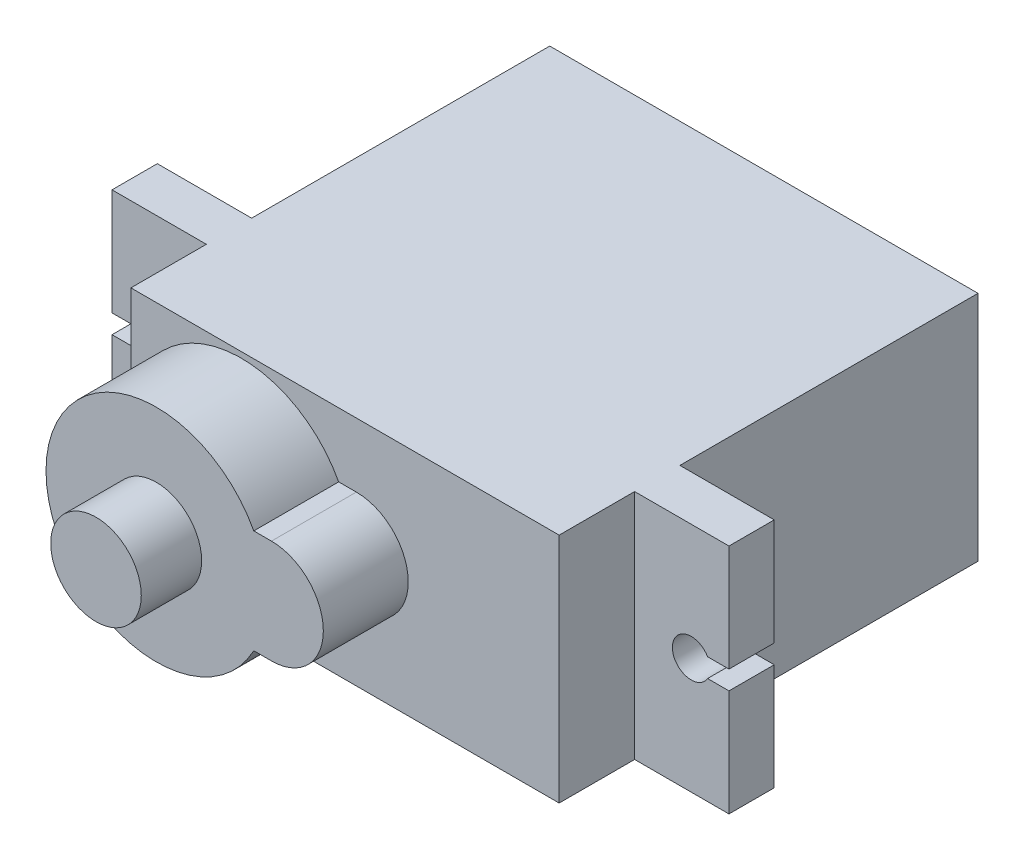
from build123d import *

# Parameters (mm, degrees)
SZKIC1_W                         = 22.7
SZKIC1_H                         = 12.3
DODANIE_WYCI_GNI_CIE1_DEPTH      = 22.2
DODANIE_WYCI_GNI_CIE2_DEPTH      = 5
DODANIE_WYCI_GNI_CIE2_DEPTH_BACK = 27.7
SZKIC2_W                         = 2.4
SZKIC2_H                         = 12.3
DODANIE_WYCI_GNI_CIE3_DEPTH      = 4.5
SZKIC8_R                         = 2.4
DODANIE_WYCI_GNI_CIE4_DEPTH      = 3.2
WYTNIJ_WYCI_GNI_CIE1_DEPTH       = 2.4
WYTNIJ_WYCI_GNI_CIE2_DEPTH       = 2.4
SZKIC11_R                        = 0.75
DODANIE_WYCI_GNI_CIE8_DEPTH      = 25.7


with BuildPart() as part:
    # Szkic1 → Dodanie-wyciągnięcie1 (new body)
    with BuildSketch(Plane.XY):
        with Locations((-11.570890411, -6.425490196)):
            Rectangle(SZKIC1_W, SZKIC1_H)
    extrude(amount=DODANIE_WYCI_GNI_CIE1_DEPTH)

    # Szkic2 → Dodanie-wyciągnięcie2 (add, two sides: drawn at the far end of the back side and taken through both)
    with BuildSketch(Plane(origin=(-0.220890411, 0, 0), x_dir=(0, 0, -1), z_dir=(1, 0, 0)).offset(-DODANIE_WYCI_GNI_CIE2_DEPTH_BACK)):
        with Locations((-17, -6.425490196)):
            Rectangle(SZKIC2_W, SZKIC2_H)
    extrude(amount=DODANIE_WYCI_GNI_CIE2_DEPTH + DODANIE_WYCI_GNI_CIE2_DEPTH_BACK)

    # Szkic3 → Dodanie-wyciągnięcie3 (add)
    with BuildSketch(Plane.XY.offset(22.2)):
        with BuildLine():
            Line((-10.970890411, -9.175490196), (-11.907558154, -9.175490196))
            ThreePointArc((-11.907558154, -9.175490196), (-22.920890411, -6.425490196), (-11.907558154, -3.675490196))
            Line((-11.907558154, -3.675490196), (-10.970890411, -3.675490196))
            ThreePointArc((-10.970890411, -3.675490196), (-8.220890411, -6.425490196), (-10.970890411, -9.175490196))
        make_face()
    extrude(amount=DODANIE_WYCI_GNI_CIE3_DEPTH)

    # Szkic8 → Dodanie-wyciągnięcie4 (add)
    with BuildSketch(Plane.XY.offset(26.7)):
        with Locations((-17.070890411, -6.425490196)):
            Circle(SZKIC8_R)
    extrude(amount=DODANIE_WYCI_GNI_CIE4_DEPTH)

    # Szkic9 → Wytnij-wyciągnięcie1 (cut)
    with BuildSketch(Plane.XY.offset(18.2)):
        with BuildLine():
            Line((4.779109589, -6.425490196), (4.779109589, -5.925490196))
            Line((4.779109589, -5.925490196), (3.645134993, -5.925490196))
            ThreePointArc((3.645134993, -5.925490196), (1.779109589, -6.425490196), (3.645134993, -6.925490196))
            Line((3.645134993, -6.925490196), (4.779109589, -6.925490196))
            Line((4.779109589, -6.925490196), (4.779109589, -6.425490196))
        make_face()
    extrude(amount=-WYTNIJ_WYCI_GNI_CIE1_DEPTH, mode=Mode.SUBTRACT)

    # Szkic10 → Wytnij-wyciągnięcie2 (cut)
    with BuildSketch(Plane.XY.offset(18.2)):
        with BuildLine():
            Line((-27.920890411, -5.925490196), (-27.920890411, -6.925490196))
            Line((-27.920890411, -6.925490196), (-26.786915815, -6.925490196))
            ThreePointArc((-26.786915815, -6.925490196), (-24.920890411, -6.425490196), (-26.786915815, -5.925490196))
            Line((-26.786915815, -5.925490196), (-27.920890411, -5.925490196))
        make_face()
    extrude(amount=-WYTNIJ_WYCI_GNI_CIE2_DEPTH, mode=Mode.SUBTRACT)

    # Szkic11 → Dodanie-wyciągnięcie8 (add)
    with BuildSketch(Plane(origin=(-0.220890411, 0, 0), x_dir=(0, 0, -1), z_dir=(1, 0, 0))):
        with Locations((-4.75, -6.425490196)):
            Circle(SZKIC11_R)
        with Locations((-4.75, -4.915490196)):
            Circle(SZKIC11_R)
        with Locations((-4.75, -7.935490196)):
            Circle(SZKIC11_R)
    extrude(amount=-DODANIE_WYCI_GNI_CIE8_DEPTH)


solid = part.part
